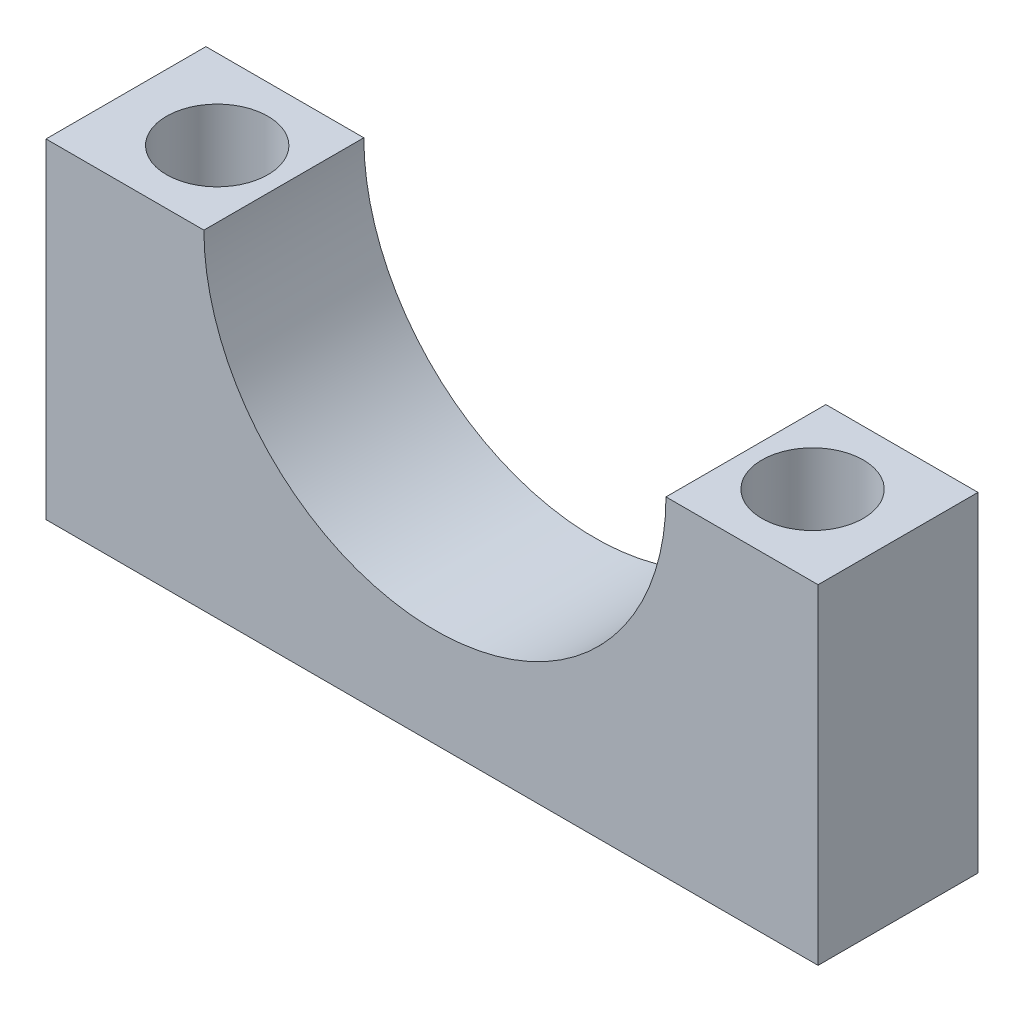
from build123d import *

# Parameters (mm, degrees)
BOSS_EXTRUDE1_DEPTH = 5.52
SKETCH2_R           = 1.75
CUT_EXTRUDE1_DEPTH  = 30.499106766


with BuildPart() as part:
    # Sketch1 → Boss-Extrude1 (new body)
    with BuildSketch(Plane.XY):
        with BuildLine():
            Line((21.4, 11.38), (26.65, 11.38))
            Line((26.65, 11.38), (26.65, 0))
            Line((26.65, 0), (0, 0))
            Line((0, 0), (0, 11.38))
            Line((0, 11.38), (5.45, 11.38))
            ThreePointArc((5.45, 11.38), (13.425, 3.405), (21.4, 11.38))
        make_face()
    extrude(amount=BOSS_EXTRUDE1_DEPTH)

    # Sketch2 → Cut-Extrude1 (cut, through all)
    with BuildSketch(Plane(origin=(0, 11.38, 0), x_dir=(1, 0, 0), z_dir=(0, 1, 0))):
        with Locations(Location((3.15, -2.76, 0), (0, 0, 270))):
            Circle(SKETCH2_R)
        with Locations(Location((23.7, -2.76, 0), (0, 0, 90))):
            Circle(SKETCH2_R)
    extrude(amount=-CUT_EXTRUDE1_DEPTH, mode=Mode.SUBTRACT)


solid = part.part
